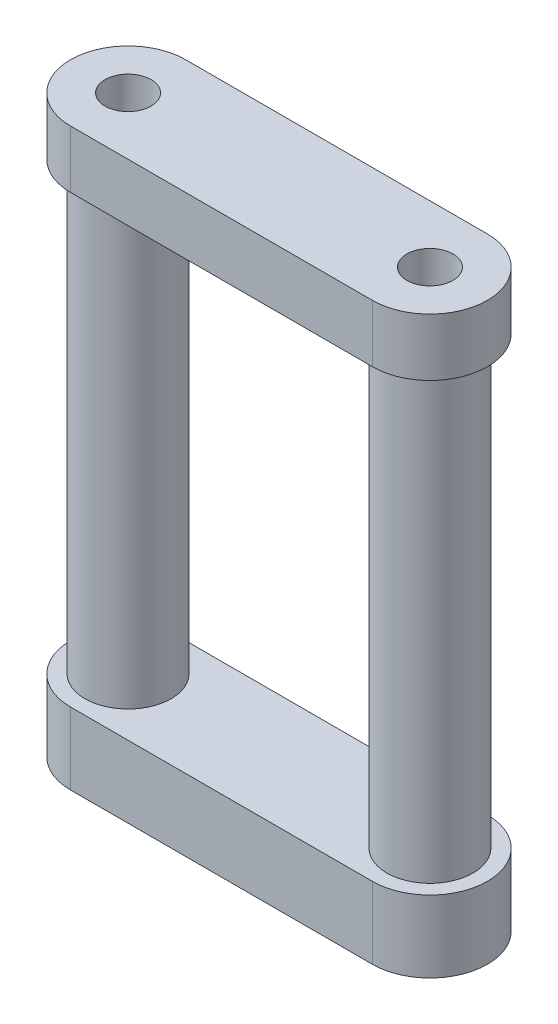
from build123d import *

# Parameters (mm, degrees)
SKETCH_1_R        = 1.5
EXTRUDE_1_DEPTH   = 5
SKETCH_2_R        = 3
SKETCH_2_R_2      = 1.6
EXTRUDE_2_DEPTH   = 31
EXTRUDE_2_2_DEPTH = 31
SKETCH_3_R        = 1.6
EXTRUDE_3_DEPTH   = 4


with BuildPart() as part:
    # ｽｹｯﾁ1 → ﾎﾞｽ - 押し出し1 (new body)
    with BuildSketch(Plane(origin=(0, 0, 0), x_dir=(1, 0, 0), z_dir=(0, 1, 0))):
        with BuildLine():
            Line((-10.5, 4), (10.5, 4))
            ThreePointArc((10.5, 4), (14.5, 0), (10.5, -4))
            Line((10.5, -4), (-10.5, -4))
            ThreePointArc((-10.5, -4), (-14.5, 0), (-10.5, 4))
        make_face()
        with Locations(Location((-10.5, 0, 0), (0, 0, 270))):
            Circle(SKETCH_1_R, mode=Mode.SUBTRACT)
        with Locations(Location((10.5, 0, 0), (0, 0, 270))):
            Circle(SKETCH_1_R, mode=Mode.SUBTRACT)
    extrude(amount=EXTRUDE_1_DEPTH)


with BuildPart() as body_2:
    # ｽｹｯﾁ2 → ﾎﾞｽ - 押し出し2 (new body)
    with BuildSketch(Plane(origin=(0, 5, 0), x_dir=(1, 0, 0), z_dir=(0, 1, 0))):
        with Locations(Location((-10.5, 0, 0), (0, 0, 270))):
            Circle(SKETCH_2_R)
        with Locations(Location((-10.5, 0, 0), (0, 0, 270))):
            Circle(SKETCH_2_R_2, mode=Mode.SUBTRACT)
    extrude(amount=EXTRUDE_2_DEPTH)


with BuildPart() as body_3:
    # ｽｹｯﾁ2 → Extrude 2 2 (new body)
    with BuildSketch(Plane(origin=(0, 5, 0), x_dir=(1, 0, 0), z_dir=(0, 1, 0))):
        with Locations(Location((10.5, 0, 0), (0, 0, 270))):
            Circle(SKETCH_2_R)
        with Locations(Location((10.5, 0, 0), (0, 0, 270))):
            Circle(SKETCH_2_R_2, mode=Mode.SUBTRACT)
    extrude(amount=EXTRUDE_2_2_DEPTH)


with BuildPart() as body_4:
    # ｽｹｯﾁ3 → ﾎﾞｽ - 押し出し3 (new body)
    with BuildSketch(Plane(origin=(0, 36, 0), x_dir=(1, 0, 0), z_dir=(0, 1, 0))):
        with BuildLine():
            Line((-10.5, -4), (10.5, -4))
            ThreePointArc((10.5, -4), (14.5, 0), (10.5, 4))
            Line((10.5, 4), (-10.5, 4))
            ThreePointArc((-10.5, 4), (-14.5, 0), (-10.5, -4))
        make_face()
        with Locations(Location((10.5, 0, 0), (0, 0, 270))):
            Circle(SKETCH_3_R, mode=Mode.SUBTRACT)
        with Locations(Location((-10.5, 0, 0), (0, 0, 270))):
            Circle(SKETCH_3_R, mode=Mode.SUBTRACT)
    extrude(amount=EXTRUDE_3_DEPTH)


solid = Compound([part.part, body_2.part, body_3.part, body_4.part])
